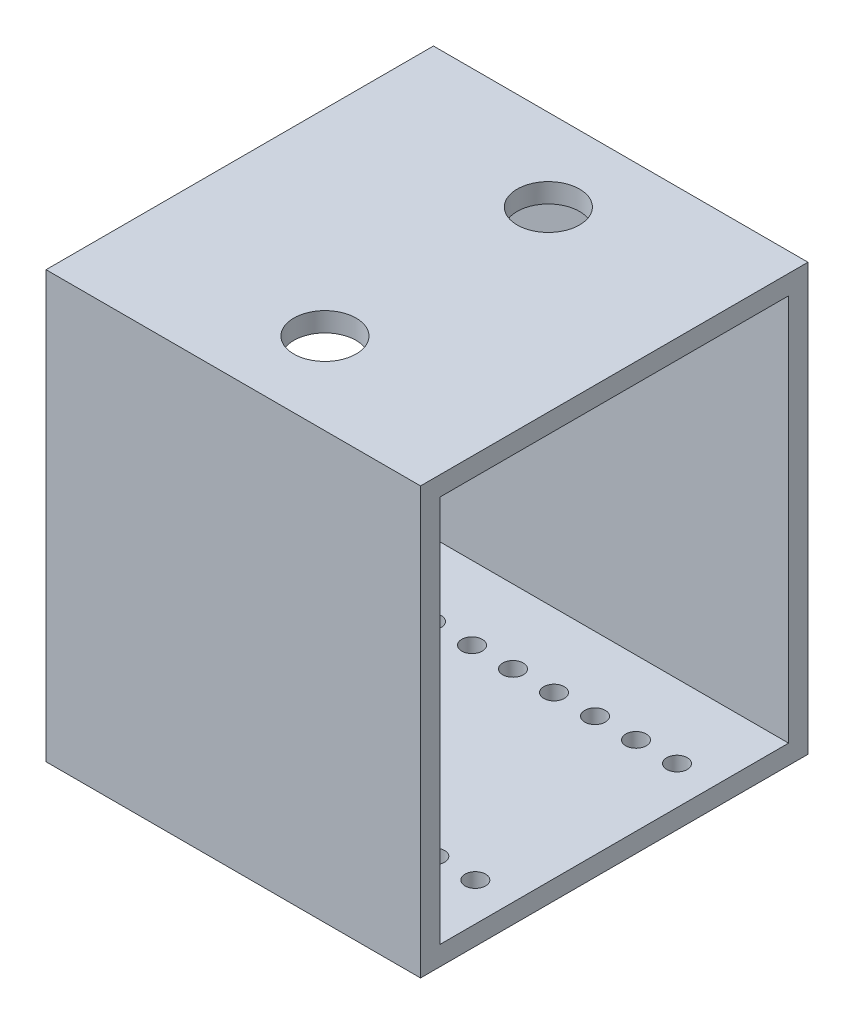
from build123d import *

# Parameters (mm, degrees)
BOSS_EXTRUDE1_DEPTH = 60
CUT_EXTRUDE1_REACH  = 104.255
SKETCH2_R           = 1.59
SKETCH3_W           = 42
SKETCH3_H           = 48
CUT_EXTRUDE2_DEPTH  = 60
SKETCH6_W           = 3
SKETCH6_H           = 60
BOSS_EXTRUDE2_DEPTH = 55
SKETCH4_R           = 4.826
CUT_EXTRUDE3_DEPTH  = 109.474


with BuildPart() as part:
    # Sketch1 → Boss-Extrude1 (new body)
    with BuildSketch(Plane.XY):
        Polygon((8, 30), (-47, 30), (-47, -30), (8, -30), (8, -33), (-50, -33), (-50, 33), (8, 33), align=None)
    extrude(amount=BOSS_EXTRUDE1_DEPTH)

    # Sketch2 → Cut-Extrude1 (cut, up to next)
    with BuildSketch(Plane.XZ.offset(33), mode=Mode.PRIVATE) as cut_extrude1_sk1:
        with Locations(Location((-36, 45.62, 0), (0, 0, 270))):
            Circle(SKETCH2_R)
    cut_extrude1_tool1 = extrude(cut_extrude1_sk1.sketch, amount=-CUT_EXTRUDE1_REACH, mode=Mode.PRIVATE) & part.part
    # Sketch2 → Cut-Extrude1 (cut, up to next)
    with BuildSketch(Plane.XZ.offset(33), mode=Mode.PRIVATE) as cut_extrude1_sk2:
        with Locations(Location((-29.65, 45.62, 0), (0, 0, 270))):
            Circle(SKETCH2_R)
    cut_extrude1_tool2 = extrude(cut_extrude1_sk2.sketch, amount=-CUT_EXTRUDE1_REACH, mode=Mode.PRIVATE) & part.part
    # Sketch2 → Cut-Extrude1 (cut, up to next)
    with BuildSketch(Plane.XZ.offset(33), mode=Mode.PRIVATE) as cut_extrude1_sk3:
        with Locations(Location((-23.3, 45.62, 0), (0, 0, 270))):
            Circle(SKETCH2_R)
    cut_extrude1_tool3 = extrude(cut_extrude1_sk3.sketch, amount=-CUT_EXTRUDE1_REACH, mode=Mode.PRIVATE) & part.part
    # Sketch2 → Cut-Extrude1 (cut, up to next)
    with BuildSketch(Plane.XZ.offset(33), mode=Mode.PRIVATE) as cut_extrude1_sk4:
        with Locations(Location((-16.95, 45.62, 0), (0, 0, 270))):
            Circle(SKETCH2_R)
    cut_extrude1_tool4 = extrude(cut_extrude1_sk4.sketch, amount=-CUT_EXTRUDE1_REACH, mode=Mode.PRIVATE) & part.part
    # Sketch2 → Cut-Extrude1 (cut, up to next)
    with BuildSketch(Plane.XZ.offset(33), mode=Mode.PRIVATE) as cut_extrude1_sk5:
        with Locations(Location((-10.6, 45.62, 0), (0, 0, 270))):
            Circle(SKETCH2_R)
    cut_extrude1_tool5 = extrude(cut_extrude1_sk5.sketch, amount=-CUT_EXTRUDE1_REACH, mode=Mode.PRIVATE) & part.part
    # Sketch2 → Cut-Extrude1 (cut, up to next)
    with BuildSketch(Plane.XZ.offset(33), mode=Mode.PRIVATE) as cut_extrude1_sk6:
        with Locations(Location((-4.25, 45.62, 0), (0, 0, 270))):
            Circle(SKETCH2_R)
    cut_extrude1_tool6 = extrude(cut_extrude1_sk6.sketch, amount=-CUT_EXTRUDE1_REACH, mode=Mode.PRIVATE) & part.part
    # Sketch2 → Cut-Extrude1 (cut, up to next)
    with BuildSketch(Plane.XZ.offset(33), mode=Mode.PRIVATE) as cut_extrude1_sk7:
        with Locations(Location((2.1, 45.62, 0), (0, 0, 270))):
            Circle(SKETCH2_R)
    cut_extrude1_tool7 = extrude(cut_extrude1_sk7.sketch, amount=-CUT_EXTRUDE1_REACH, mode=Mode.PRIVATE) & part.part
    # Sketch2 → Cut-Extrude1 (cut, up to next)
    with BuildSketch(Plane.XZ.offset(33), mode=Mode.PRIVATE) as cut_extrude1_sk8:
        with Locations(Location((-29.65, 14.38, 0), (0, 0, 270))):
            Circle(SKETCH2_R)
    cut_extrude1_tool8 = extrude(cut_extrude1_sk8.sketch, amount=-CUT_EXTRUDE1_REACH, mode=Mode.PRIVATE) & part.part
    # Sketch2 → Cut-Extrude1 (cut, up to next)
    with BuildSketch(Plane.XZ.offset(33), mode=Mode.PRIVATE) as cut_extrude1_sk9:
        with Locations(Location((-23.3, 14.38, 0), (0, 0, 270))):
            Circle(SKETCH2_R)
    cut_extrude1_tool9 = extrude(cut_extrude1_sk9.sketch, amount=-CUT_EXTRUDE1_REACH, mode=Mode.PRIVATE) & part.part
    # Sketch2 → Cut-Extrude1 (cut, up to next)
    with BuildSketch(Plane.XZ.offset(33), mode=Mode.PRIVATE) as cut_extrude1_sk10:
        with Locations(Location((-16.95, 14.38, 0), (0, 0, 270))):
            Circle(SKETCH2_R)
    cut_extrude1_tool10 = extrude(cut_extrude1_sk10.sketch, amount=-CUT_EXTRUDE1_REACH, mode=Mode.PRIVATE) & part.part
    # Sketch2 → Cut-Extrude1 (cut, up to next)
    with BuildSketch(Plane.XZ.offset(33), mode=Mode.PRIVATE) as cut_extrude1_sk11:
        with Locations(Location((-10.6, 14.38, 0), (0, 0, 270))):
            Circle(SKETCH2_R)
    cut_extrude1_tool11 = extrude(cut_extrude1_sk11.sketch, amount=-CUT_EXTRUDE1_REACH, mode=Mode.PRIVATE) & part.part
    # Sketch2 → Cut-Extrude1 (cut, up to next)
    with BuildSketch(Plane.XZ.offset(33), mode=Mode.PRIVATE) as cut_extrude1_sk12:
        with Locations(Location((-4.25, 14.38, 0), (0, 0, 270))):
            Circle(SKETCH2_R)
    cut_extrude1_tool12 = extrude(cut_extrude1_sk12.sketch, amount=-CUT_EXTRUDE1_REACH, mode=Mode.PRIVATE) & part.part
    # Sketch2 → Cut-Extrude1 (cut, up to next)
    with BuildSketch(Plane.XZ.offset(33), mode=Mode.PRIVATE) as cut_extrude1_sk13:
        with Locations(Location((2.1, 14.38, 0), (0, 0, 270))):
            Circle(SKETCH2_R)
    cut_extrude1_tool13 = extrude(cut_extrude1_sk13.sketch, amount=-CUT_EXTRUDE1_REACH, mode=Mode.PRIVATE) & part.part
    # Sketch2 → Cut-Extrude1 (cut, up to next)
    with BuildSketch(Plane.XZ.offset(33), mode=Mode.PRIVATE) as cut_extrude1_sk14:
        with Locations(Location((-36, 14.38, 0), (0, 0, 270))):
            Circle(SKETCH2_R)
    cut_extrude1_tool14 = extrude(cut_extrude1_sk14.sketch, amount=-CUT_EXTRUDE1_REACH, mode=Mode.PRIVATE) & part.part
    add(cut_extrude1_tool1.solids().sort_by_distance((-36, -33, 45.62))[0], mode=Mode.SUBTRACT)
    add(cut_extrude1_tool2.solids().sort_by_distance((-29.65, -33, 45.62))[0], mode=Mode.SUBTRACT)
    add(cut_extrude1_tool3.solids().sort_by_distance((-23.3, -33, 45.62))[0], mode=Mode.SUBTRACT)
    add(cut_extrude1_tool4.solids().sort_by_distance((-16.95, -33, 45.62))[0], mode=Mode.SUBTRACT)
    add(cut_extrude1_tool5.solids().sort_by_distance((-10.6, -33, 45.62))[0], mode=Mode.SUBTRACT)
    add(cut_extrude1_tool6.solids().sort_by_distance((-4.25, -33, 45.62))[0], mode=Mode.SUBTRACT)
    add(cut_extrude1_tool7.solids().sort_by_distance((2.1, -33, 45.62))[0], mode=Mode.SUBTRACT)
    add(cut_extrude1_tool8.solids().sort_by_distance((-29.65, -33, 14.38))[0], mode=Mode.SUBTRACT)
    add(cut_extrude1_tool9.solids().sort_by_distance((-23.3, -33, 14.38))[0], mode=Mode.SUBTRACT)
    add(cut_extrude1_tool10.solids().sort_by_distance((-16.95, -33, 14.38))[0], mode=Mode.SUBTRACT)
    add(cut_extrude1_tool11.solids().sort_by_distance((-10.6, -33, 14.38))[0], mode=Mode.SUBTRACT)
    add(cut_extrude1_tool12.solids().sort_by_distance((-4.25, -33, 14.38))[0], mode=Mode.SUBTRACT)
    add(cut_extrude1_tool13.solids().sort_by_distance((2.1, -33, 14.38))[0], mode=Mode.SUBTRACT)
    add(cut_extrude1_tool14.solids().sort_by_distance((-36, -33, 14.38))[0], mode=Mode.SUBTRACT)

    # Sketch3 → Cut-Extrude2 (cut)
    with BuildSketch(Plane.ZY.offset(50)):
        with Locations((30, 0)):
            Rectangle(SKETCH3_W, SKETCH3_H)
    extrude(amount=-CUT_EXTRUDE2_DEPTH, mode=Mode.SUBTRACT)

    # Sketch6 → Boss-Extrude2 (add)
    with BuildSketch(Plane(origin=(-47, 0, 0), x_dir=(0, 0, -1), z_dir=(1, 0, 0))):
        with Locations((-58.5, 0)):
            Rectangle(SKETCH6_W, SKETCH6_H)
        with Locations((-1.5, 0)):
            Rectangle(SKETCH6_W, SKETCH6_H)
    extrude(amount=BOSS_EXTRUDE2_DEPTH)

    # Sketch4 → Cut-Extrude3 (cut)
    with BuildSketch(Plane(origin=(-21.609229067, 30, -179.024422281), x_dir=(1, 0, 0), z_dir=(0, -1, 0))):
        with Locations((2.104243746, 226.324422281)):
            Circle(SKETCH4_R)
        with Locations((2.104243746, 191.724422281)):
            Circle(SKETCH4_R)
    extrude(amount=-CUT_EXTRUDE3_DEPTH, mode=Mode.SUBTRACT)


solid = part.part
